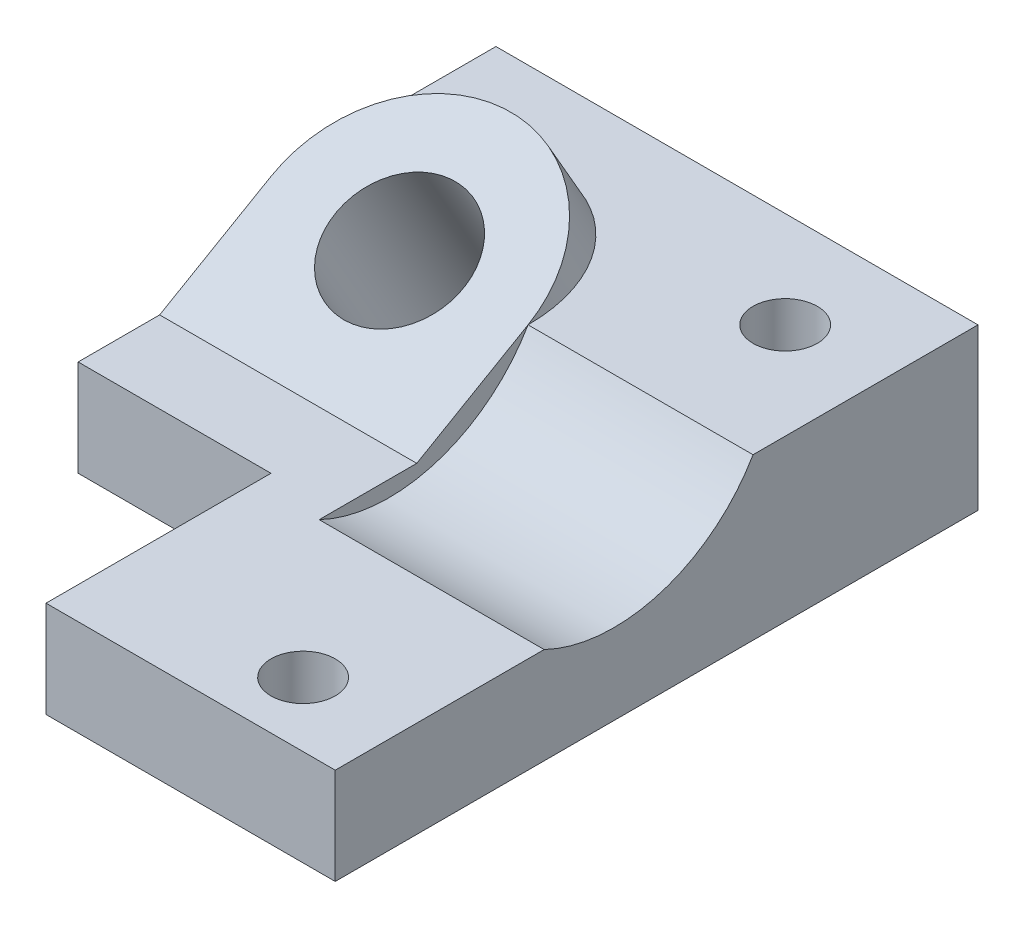
from build123d import *

# Parameters (mm, degrees)
BOSS_EXTRUDE1_DEPTH = 75
SKETCH3_W           = 30
SKETCH3_H           = 35
CUT_EXTRUDE1_DEPTH  = 75
BOSS_EXTRUDE2_DEPTH = 40
BOSS_EXTRUDE3_DEPTH = 26
SKETCH6_R           = 10
CUT_EXTRUDE2_DEPTH  = 97.492272876
BOSS_EXTRUDE4_DEPTH = 37
CUT_EXTRUDE3_DEPTH  = 35
SKETCH9_R           = 5
CUT_EXTRUDE4_DEPTH  = 35


with BuildPart() as part:
    # Sketch2 → Boss-Extrude1 (new body)
    with BuildSketch(Plane(origin=(0, 0, 0), x_dir=(0, 0, -1), z_dir=(1, 0, 0))):
        Polygon((-68.973908168, 0), (-68.973908168, 15), (-3.973908168, 15), (-3.973908168, 25), (31.026091832, 25), (31.026091832, 0), align=None)
    extrude(amount=-BOSS_EXTRUDE1_DEPTH)

    # Sketch3 → Cut-Extrude1 (cut)
    with BuildSketch(Plane(origin=(0, 15, 0), x_dir=(1, 0, 0), z_dir=(0, 1, 0))):
        with Locations((-60, -51.473908168)):
            Rectangle(SKETCH3_W, SKETCH3_H)
    extrude(amount=-CUT_EXTRUDE1_DEPTH, mode=Mode.SUBTRACT)

    # Sketch4 → Boss-Extrude2 (add)
    with BuildSketch(Plane.ZY.offset(75)):
        Polygon((3.973908168, 25), (21.294416244, 15), (3.973908168, 15), align=None)
    extrude(amount=-BOSS_EXTRUDE2_DEPTH)

    # Sketch5 → Boss-Extrude3 (add)
    with BuildSketch(Plane(origin=(0, 20.470752713, 11.818794589), x_dir=(1, 0, 0), z_dir=(0, 0.866025403784438, 0.5000000000000012))):
        with BuildLine():
            Line((-75, 9.058494574), (-35, 9.058494574))
            ThreePointArc((-35, 9.058494574), (-55, 29.058494574), (-75, 9.058494574))
        make_face()
    extrude(amount=-BOSS_EXTRUDE3_DEPTH)

    # Sketch6 → Cut-Extrude2 (cut, through all)
    with BuildSketch(Plane(origin=(0, 20.470752713, 11.818794589), x_dir=(1, 0, 0), z_dir=(0, 0.866025403784438, 0.5000000000000012))):
        with Locations((-55, 9.058494574)):
            Circle(SKETCH6_R)
    extrude(amount=-CUT_EXTRUDE2_DEPTH, mode=Mode.SUBTRACT)

    # Sketch8 → Boss-Extrude4 (add)
    with BuildSketch(Plane(origin=(0, 0, 0), x_dir=(0, 0, -1), z_dir=(1, 0, 0))):
        Polygon((-3.973908168, 15), (-3.973908168, 25), (-21.294416244, 15), align=None)
    extrude(amount=-BOSS_EXTRUDE4_DEPTH)

    # Sketch8<3> → Cut-Extrude3 (cut)
    with BuildSketch(Plane(origin=(0, 0, 0), x_dir=(0, 0, -1), z_dir=(1, 0, 0))):
        with BuildLine():
            ThreePointArc((-36.473908168, 15), (-18.261943211, 13.623613889), (-3.973908168, 25))
            Line((-3.973908168, 25), (-21.294416244, 15))
            Line((-21.294416244, 15), (-36.473908168, 15))
        make_face()
    extrude(amount=-CUT_EXTRUDE3_DEPTH, mode=Mode.SUBTRACT)

    # Sketch9 → Cut-Extrude4 (cut)
    with BuildSketch(Plane(origin=(0, 25, 0), x_dir=(1, 0, 0), z_dir=(0, 1, 0))):
        with Locations((-15, 16.026091832)):
            Circle(SKETCH9_R)
        with Locations((-15, -58.973908168)):
            Circle(SKETCH9_R)
    extrude(amount=-CUT_EXTRUDE4_DEPTH, mode=Mode.SUBTRACT)


solid = part.part
